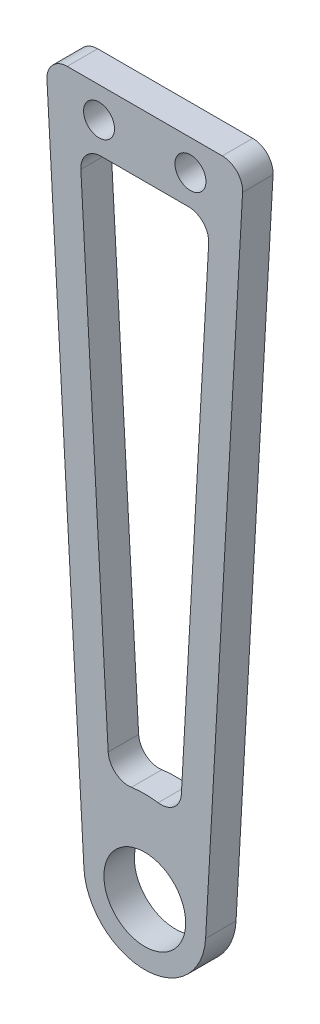
from build123d import *

# Parameters (mm, degrees)
SKETCH_1_R          = 11
SKETCH_1_R_2        = 3.5
SKETCH_1_R_3        = 1.01
SKETCH_1_R_4        = 6
SKETCH_1_R_5        = 4.025
EXTRUDE_1_DEPTH     = 3
SKETCH_2_R          = 1.525
EXTRUDE_2_DEPTH     = 3
SKETCH_3_W          = 24.553172336
SKETCH_3_H          = 36.576889883
CUT_EXTRUDE_1_DEPTH = 10
FILLET_1_R          = 2


with BuildPart() as part:
    # 草图1 → 凸台-拉伸1 (new body)
    # profile 1 of 3: a face of its own
    with BuildSketch(Plane.XY):
        with BuildLine():
            ThreePointArc((10.983011573, -0.611111111), (0, -11), (-10.983011573, -0.611111111))
            Line((-10.983011573, -0.611111111), (-5.990733585, -90.333333333))
            ThreePointArc((-5.990733585, -90.333333333), (-0.166731054, -84.002317051), (6, -90))
            ThreePointArc((6, -90), (5.997682949, -90.166731054), (5.990733585, -90.333333333))
            Line((5.990733585, -90.333333333), (10.983011573, -0.611111111))
        make_face()
        with BuildLine():
            Line((-3.466771313, -81.694489982), (-7.418369738, -10.675569794))
            ThreePointArc((-7.418369738, -10.675569794), (0, -13), (7.418369738, -10.675569794))
            Line((7.418369738, -10.675569794), (3.466771313, -81.694489982))
            ThreePointArc((3.466771313, -81.694489982), (0, -81), (-3.466771313, -81.694489982))
        make_face(mode=Mode.SUBTRACT)
    # profile 2 of 3: a face of its own
    with BuildSketch(Plane.XY):
        Circle(SKETCH_1_R)
        Circle(SKETCH_1_R_2, mode=Mode.SUBTRACT)
        with Locations((-2.75, 4.763139721)):
            Circle(SKETCH_1_R_3, mode=Mode.SUBTRACT)
        with Locations((-2.75, -4.763139721)):
            Circle(SKETCH_1_R_3, mode=Mode.SUBTRACT)
        with Locations((5.5, 0)):
            Circle(SKETCH_1_R_3, mode=Mode.SUBTRACT)
    # profile 3 of 3: a face of its own
    with BuildSketch(Plane.XY):
        with Locations((0, -90)):
            Circle(SKETCH_1_R_4)
        with Locations((0, -90)):
            Circle(SKETCH_1_R_5, mode=Mode.SUBTRACT)
    extrude(amount=EXTRUDE_1_DEPTH)

    # 草图2 → 凸台-拉伸2 (add)
    with BuildSketch(Plane.XY.offset(3)):
        Polygon((-6.745155967, -22.774702841), (6.745155967, -22.774702841), (6.411307036, -28.774702841), (-6.411307036, -28.774702841), align=None)
        with Locations((-4.5, -25.774702841)):
            Circle(SKETCH_2_R, mode=Mode.SUBTRACT)
        with Locations((4.5, -25.774702841)):
            Circle(SKETCH_2_R, mode=Mode.SUBTRACT)
    extrude(amount=-EXTRUDE_2_DEPTH)

    # 草图3 → 切除-拉伸1 (cut)
    with BuildSketch(Plane.XY.offset(3)):
        with Locations((0.16395552, -4.486257899)):
            Rectangle(SKETCH_3_W, SKETCH_3_H)
    extrude(amount=-CUT_EXTRUDE_1_DEPTH, mode=Mode.SUBTRACT)

    # 圆角1
    fillet_1_edges = [part.edges().sort_by_distance(p)[0] for p in [
        (-3.466771313, -81.694489982, 1.5),
        (3.466771313, -81.694489982, 1.5),
        (6.411307036, -28.774702841, 1.5),
        (-6.411307036, -28.774702841, 1.5),
        (-9.749796341, -22.774702841, 1.5),
        (9.749796341, -22.774702841, 1.5),
    ]]
    fillet(fillet_1_edges, radius=FILLET_1_R)


solid = part.part
